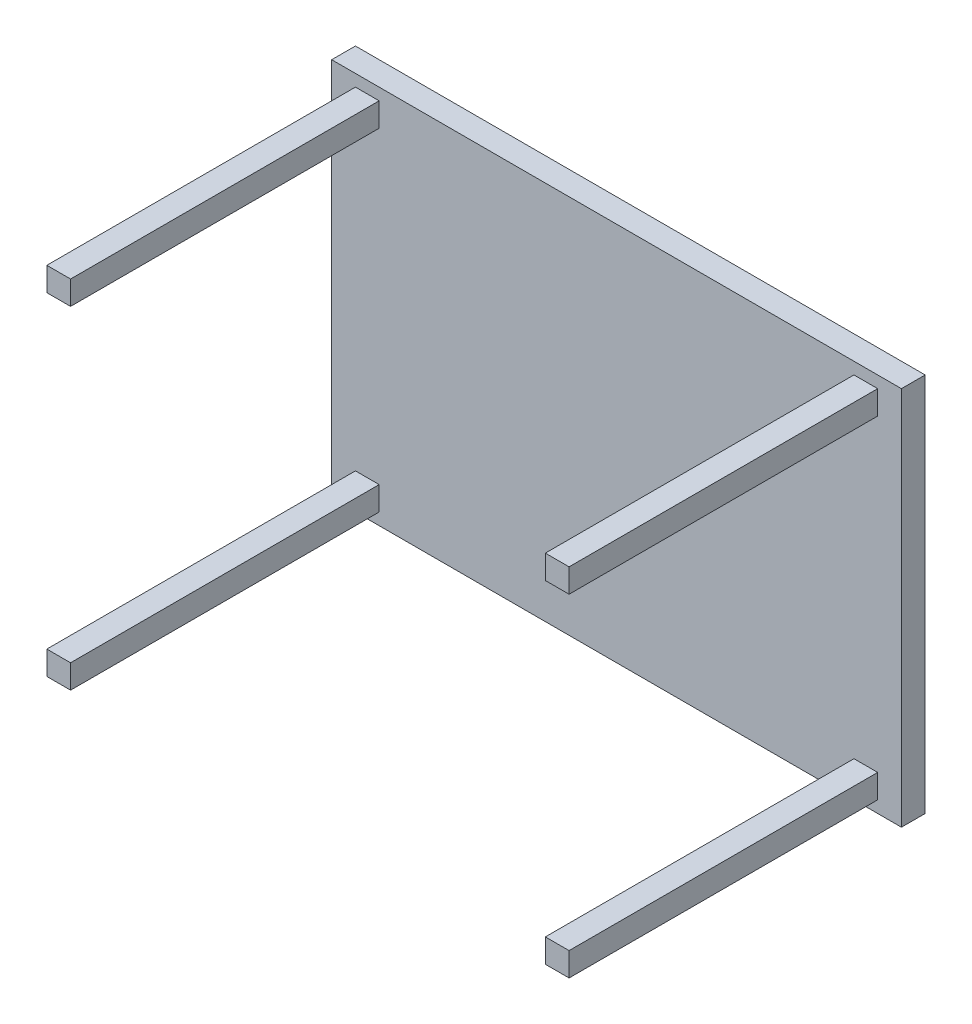
from build123d import *

# Parameters (mm, degrees)
SKETCH_1_W          = 1200
SKETCH_1_H          = 800
EXTRUDE_1_DEPTH     = 50
SKETCH_2_W          = 50
SKETCH_2_H          = 50
EXTRUDE_2_DEPTH     = 700
SKETCH_3_W          = 50
SKETCH_3_H          = 50
EXTRUDE_3_DEPTH     = 700
SKETCH_4_W          = 50
SKETCH_4_H          = 50
EXTRUDE_4_DEPTH     = 700
SKETCH_5_W          = 50
SKETCH_5_H          = 50
EXTRUDE_5_DEPTH     = 700
SKETCH_6_R          = 200
CUT_EXTRUDE_1_DEPTH = 20


with BuildPart() as part:
    # 草图1 → 凸台-拉伸1 (new body)
    with BuildSketch(Plane.XY):
        Rectangle(SKETCH_1_W, SKETCH_1_H)
    extrude(amount=EXTRUDE_1_DEPTH)

    # 草图2 → 凸台-拉伸2 (add)
    with BuildSketch(Plane.XY):
        with Locations((525, 350)):
            Rectangle(SKETCH_2_W, SKETCH_2_H)
    extrude(amount=EXTRUDE_2_DEPTH)

    # 草图3 → 凸台-拉伸3 (add)
    with BuildSketch(Plane.XY):
        with Locations((525, -350)):
            Rectangle(SKETCH_3_W, SKETCH_3_H)
    extrude(amount=EXTRUDE_3_DEPTH)

    # 草图4 → 凸台-拉伸4 (add)
    with BuildSketch(Plane.XY):
        with Locations((-525, 350)):
            Rectangle(SKETCH_4_W, SKETCH_4_H)
    extrude(amount=EXTRUDE_4_DEPTH)

    # 草图5 → 凸台-拉伸5 (add)
    with BuildSketch(Plane.XY):
        with Locations((-525, -350)):
            Rectangle(SKETCH_5_W, SKETCH_5_H)
    extrude(amount=EXTRUDE_5_DEPTH)

    # 草图6 → 切除-拉伸1 (cut)
    with BuildSketch(Plane.XY):
        Circle(SKETCH_6_R)
    extrude(amount=CUT_EXTRUDE_1_DEPTH, mode=Mode.SUBTRACT)


solid = part.part
